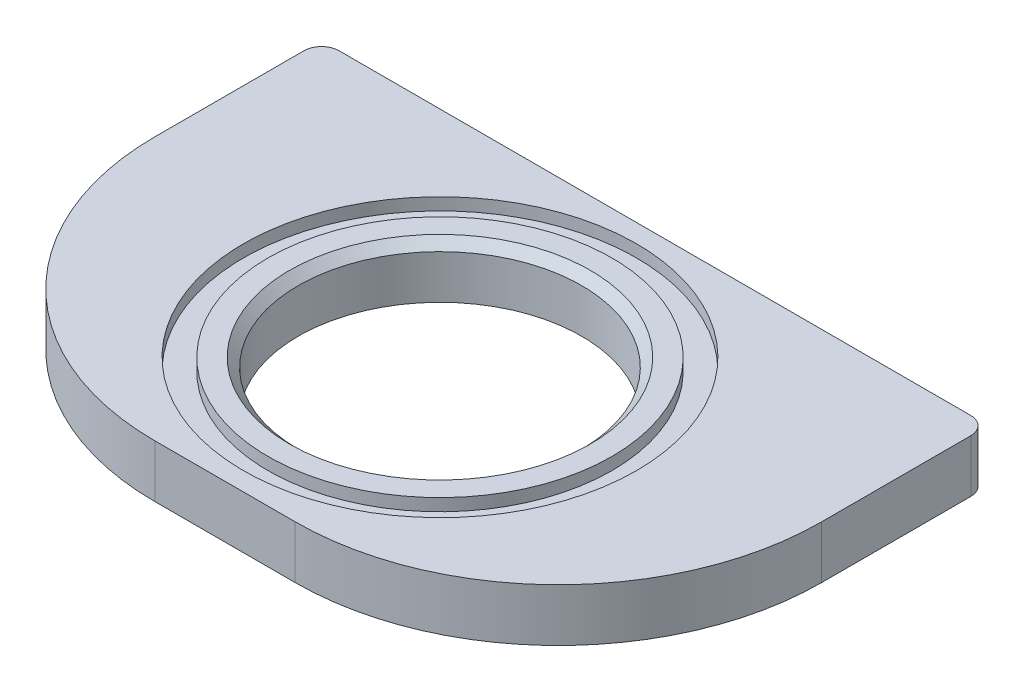
from build123d import *

# Parameters (mm, degrees)
SKETCH1_W           = 38
SKETCH1_H           = 24.5
SKETCH1_R           = 8.075
BOSS_EXTRUDE1_DEPTH = 3
FILLET1_R           = 15
SKETCH3_W           = 1.4
SKETCH3_H           = 1.4
FILLET2_R           = 1
CHAMFER1_SIZE       = 0.5


with BuildPart() as part:
    # Sketch1 → Boss-Extrude1 (new body)
    with BuildSketch(Plane(origin=(0, 0, 0), x_dir=(1, 0, 0), z_dir=(0, 1, 0))):
        Rectangle(SKETCH1_W, SKETCH1_H)
        with Locations(Location((0, 0, 0), (0, 0, 270))):
            Circle(SKETCH1_R, mode=Mode.SUBTRACT)
    extrude(amount=BOSS_EXTRUDE1_DEPTH)

    # Fillet1
    fillet1_edges = [part.edges().sort_by_distance(p)[0] for p in [
        (19, 1.5, 12.25),
        (-19, 1.5, 12.25),
    ]]
    fillet(fillet1_edges, radius=FILLET1_R)

    # Cut-Sweep1: sweep along a path in Sketch2
    with BuildLine(Plane(origin=(0, 3, 0), x_dir=(1, 0, 0), z_dir=(0, 1, 0))) as cut_sweep1_path:
        CenterArc((0, 0), 10.5, 0, 360)
    # Sketch3 → Cut-Sweep1 (sweep, cut)
    with BuildSketch(Plane.XY):
        with Locations((10.5, 3)):
            Rectangle(SKETCH3_W, SKETCH3_H)
    sweep(path=cut_sweep1_path.line, mode=Mode.SUBTRACT)

    # Fillet2
    fillet2_edges = [part.edges().sort_by_distance(p)[0] for p in [
        (-19, 1.5, -12.25),
        (19, 1.5, -12.25),
    ]]
    fillet(fillet2_edges, radius=FILLET2_R)

    # Chamfer1
    chamfer1_edges = [part.edges().sort_by_distance(p)[0] for p in [
        (0, 3, -8.075),
    ]]
    chamfer(chamfer1_edges, length=CHAMFER1_SIZE)


solid = part.part
